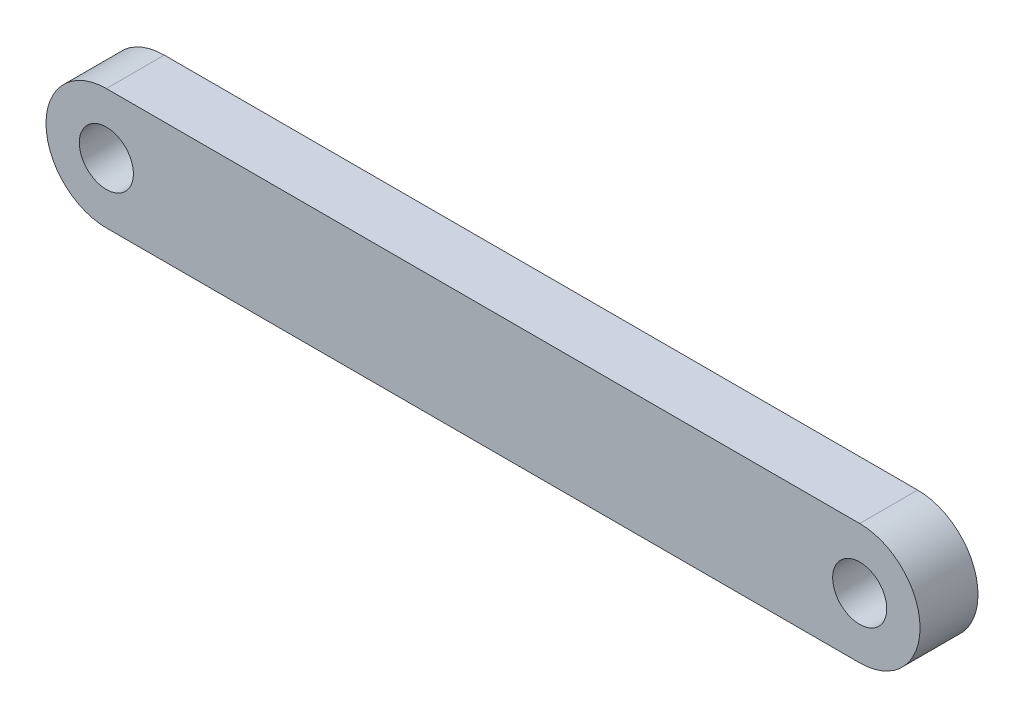
from build123d import *

# Parameters (mm, degrees)
SKETCH1_R           = 1.4224
BOSS_EXTRUDE1_DEPTH = 3.048


with BuildPart() as part:
    # Sketch1 → Boss-Extrude1 (new body)
    with BuildSketch(Plane.XY):
        with BuildLine():
            Line((0, 3.175), (39.624, 3.175))
            ThreePointArc((39.624, 3.175), (42.799, 0), (39.624, -3.175))
            Line((39.624, -3.175), (0, -3.175))
            ThreePointArc((0, -3.175), (-3.175, 0), (0, 3.175))
        make_face()
        with Locations(Location((0, 0, 0), (0, 0, 180))):
            Circle(SKETCH1_R, mode=Mode.SUBTRACT)
        with Locations(Location((39.624, 0, 0), (0, 0, 180))):
            Circle(SKETCH1_R, mode=Mode.SUBTRACT)
    extrude(amount=BOSS_EXTRUDE1_DEPTH)


solid = part.part
